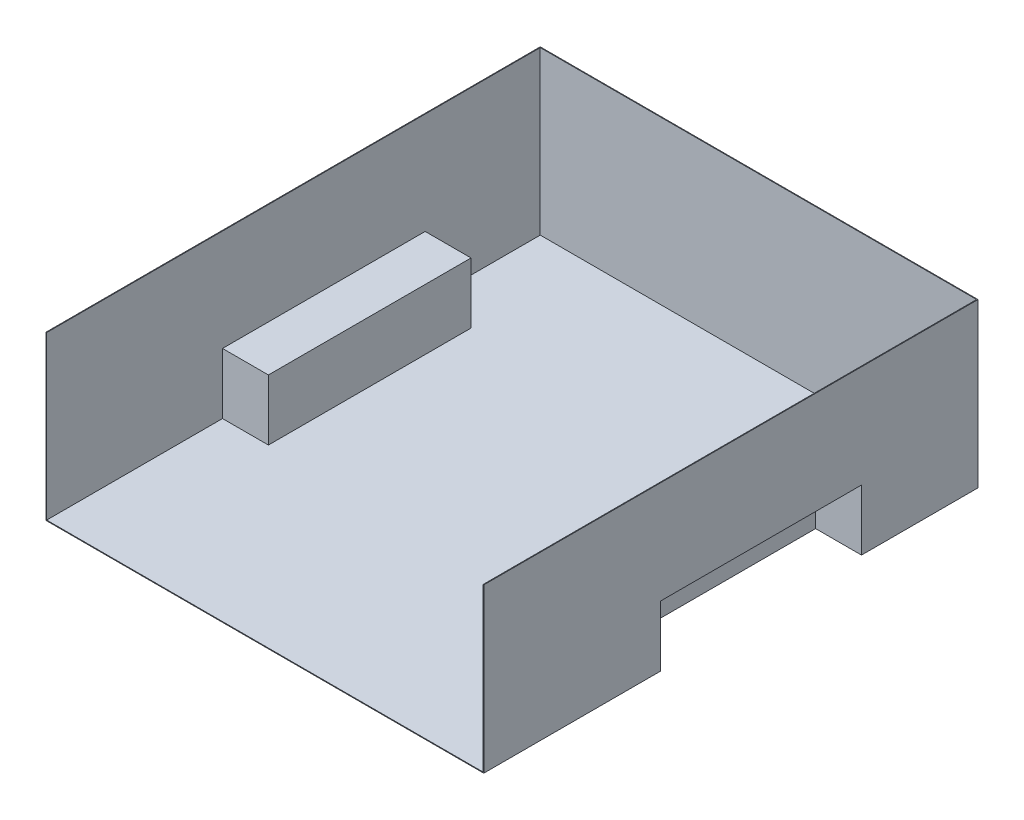
from build123d import *

# Parameters (mm, degrees)
EXTRUDE_THIN1_DEPTH = 215.9
SKETCH4_W           = 167.64
SKETCH4_H           = 728.98
BOSS_EXTRUDE3_DEPTH = 2.54
SKETCH6_W           = 1574.8
SKETCH6_H           = 1778
SKETCH6_W_2         = 1569.72
SKETCH6_H_2         = 1772.92
BOSS_EXTRUDE4_DEPTH = 368.3
BOSS_EXTRUDE6_DEPTH = 2.54
SKETCH9_W           = 1569.72
SKETCH9_H           = 2.54
CUT_EXTRUDE1_DEPTH  = 584.2


with BuildPart() as part:
    # Sketch1 → Extrude-Thin1 (new body)
    with BuildSketch(Plane(origin=(0, 0, 0), x_dir=(1, 0, 0), z_dir=(0, 1, 0))):
        Polygon((787.4, 889), (-787.4, 889), (-787.4, 469.9), (-622.3, 469.9), (-622.3, -254), (-787.4, -254), (-787.4, -889), (787.4, -889), (787.4, -254), (622.3, -254), (622.3, 469.9), (787.4, 469.9), align=None)
        Polygon((784.86, 886.46), (-784.86, 886.46), (-784.86, 472.44), (-619.76, 472.44), (-619.76, -256.54), (-784.86, -256.54), (-784.86, -886.46), (784.86, -886.46), (784.86, -256.54), (619.76, -256.54), (619.76, 472.44), (784.86, 472.44), align=None, mode=Mode.SUBTRACT)
    extrude(amount=EXTRUDE_THIN1_DEPTH)

    # Sketch4 → Boss-Extrude3 (add)
    with BuildSketch(Plane(origin=(0, 215.9, 0), x_dir=(1, 0, 0), z_dir=(0, 1, 0))):
        with Locations((-703.58, 107.95)):
            Rectangle(SKETCH4_W, SKETCH4_H)
        with Locations((703.58, 107.95)):
            Rectangle(SKETCH4_W, SKETCH4_H)
    extrude(amount=BOSS_EXTRUDE3_DEPTH)

    # Sketch6 → Boss-Extrude4 (add)
    with BuildSketch(Plane(origin=(0, 215.9, 0), x_dir=(1, 0, 0), z_dir=(0, 1, 0))):
        Rectangle(SKETCH6_W, SKETCH6_H)
        Rectangle(SKETCH6_W_2, SKETCH6_H_2, mode=Mode.SUBTRACT)
    extrude(amount=BOSS_EXTRUDE4_DEPTH)

    # Sketch8 → Boss-Extrude6 (add)
    with BuildSketch(Plane.XZ):
        Polygon((787.4, -889), (787.4, -469.9), (622.3, -469.9), (622.3, 254), (787.4, 254), (787.4, 889), (-787.4, 889), (-787.4, 254), (-622.3, 254), (-622.3, -469.9), (-787.4, -469.9), (-787.4, -889), align=None)
    extrude(amount=BOSS_EXTRUDE6_DEPTH)

    # Sketch9 → Cut-Extrude1 (cut)
    with BuildSketch(Plane(origin=(0, 584.2, 0), x_dir=(1, 0, 0), z_dir=(0, 1, 0))):
        with Locations((0, -887.73)):
            Rectangle(SKETCH9_W, SKETCH9_H)
    extrude(amount=-CUT_EXTRUDE1_DEPTH, mode=Mode.SUBTRACT)


solid = part.part
